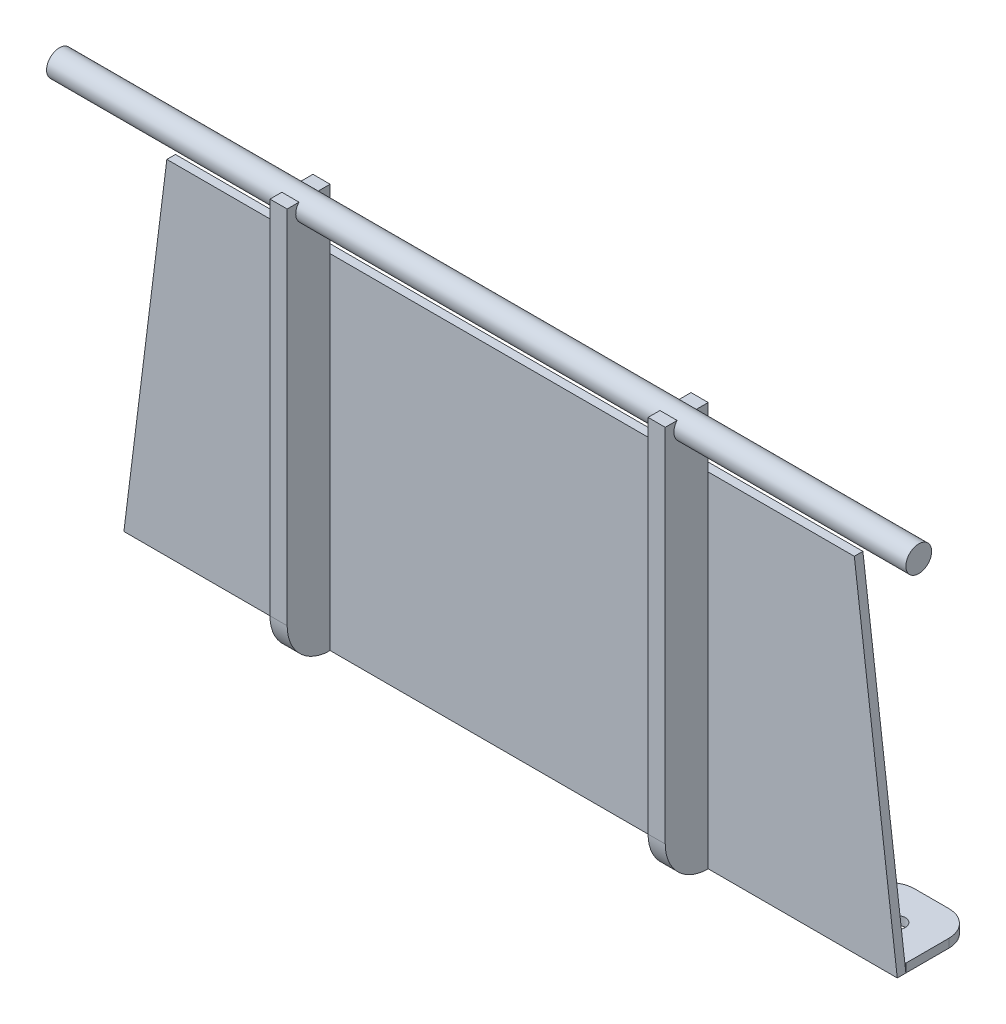
from build123d import *

# Parameters (mm, degrees)
BOSS_EXTRUDE2_DEPTH  = 1
SKETCH2_W            = 5
SKETCH2_H            = 47
BOSS_EXTRUDE3_DEPTH  = 2
FILLET2_R            = 5
FILLET2_OF_MIRROR2_R = 5
SKETCH3_R            = 1.5
BOSS_EXTRUDE5_DEPTH  = 100
SKETCH5_W            = 10
SKETCH5_H            = 8
BOSS_EXTRUDE6_DEPTH  = 1
FILLET3_R            = 3
SKETCH6_R            = 1
CUT_EXTRUDE1_DEPTH   = 1
FILLET3_OF_MIRROR4_R = 3


with BuildPart() as part:
    # Sketch1 → Boss-Extrude2 (new body)
    with BuildSketch(Plane.XY):
        Polygon((-45, 0), (45, 0), (40, 40), (-40, 40), align=None)
    extrude(amount=BOSS_EXTRUDE2_DEPTH)

    # Sketch2 → Boss-Extrude3 (add)
    with BuildSketch(Plane(origin=(21, 0, 0), x_dir=(0, 0, -1), z_dir=(1, 0, 0))):
        with Locations((-3.5, 23.5)):
            Rectangle(SKETCH2_W, SKETCH2_H)
    boss_extrude3 = extrude(amount=BOSS_EXTRUDE3_DEPTH)

    # Fillet2
    fillet2_edges = [part.edges().sort_by_distance(p)[0] for p in [
        (22, 0, 6),
    ]]
    fillet(fillet2_edges, radius=FILLET2_R)

    # Mirror2: Boss-Extrude3 across plane
    add(boss_extrude3.mirror(Plane(origin=(0, 0, 0), x_dir=(0, 0, 1), z_dir=(1, 0, 0))))

    # Fillet2 of Mirror2
    fillet2_of_mirror2_edges = [part.edges().sort_by_distance(p)[0] for p in [
        (-22, 0, 6),
    ]]
    fillet(fillet2_of_mirror2_edges, radius=FILLET2_OF_MIRROR2_R)

    # Sketch3 → Boss-Extrude5 (add)
    with BuildSketch(Plane(origin=(50, 0, 0), x_dir=(0, 0, -1), z_dir=(1, 0, 0))):
        with Locations((-3.5, 46)):
            Circle(SKETCH3_R)
    extrude(amount=-BOSS_EXTRUDE5_DEPTH)

    # Sketch5 → Boss-Extrude6 (add)
    with BuildSketch(Plane(origin=(0, 0, 0), x_dir=(1, 0, 0), z_dir=(0, 1, 0))):
        with Locations((-40, 4)):
            Rectangle(SKETCH5_W, SKETCH5_H)
    boss_extrude6 = extrude(amount=BOSS_EXTRUDE6_DEPTH)

    # Fillet3
    fillet3_edges = [part.edges().sort_by_distance(p)[0] for p in [
        (-35, 0.5, -8),
        (-45, 0.5, -8),
    ]]
    fillet(fillet3_edges, radius=FILLET3_R)

    # Sketch6 → Cut-Extrude1 (cut)
    with BuildSketch(Plane(origin=(0, 1, 0), x_dir=(1, 0, 0), z_dir=(0, 1, 0))):
        with Locations(Location((-40.376839828, 3.560660172, 0), (0, 0, 270))):
            Circle(SKETCH6_R)
    cut_extrude1 = extrude(amount=-CUT_EXTRUDE1_DEPTH, mode=Mode.SUBTRACT)

    # Mirror4: Boss-Extrude6, Cut-Extrude1 across plane
    add(boss_extrude6.mirror(Plane(origin=(0, 0, 0), x_dir=(0, 0, 1), z_dir=(1, 0, 0))))
    add(cut_extrude1.mirror(Plane(origin=(0, 0, 0), x_dir=(0, 0, 1), z_dir=(1, 0, 0))), mode=Mode.SUBTRACT)

    # Fillet3 of Mirror4
    fillet3_of_mirror4_edges = [part.edges().sort_by_distance(p)[0] for p in [
        (35, 0.5, -8),
        (45, 0.5, -8),
    ]]
    fillet(fillet3_of_mirror4_edges, radius=FILLET3_OF_MIRROR4_R)


solid = part.part
